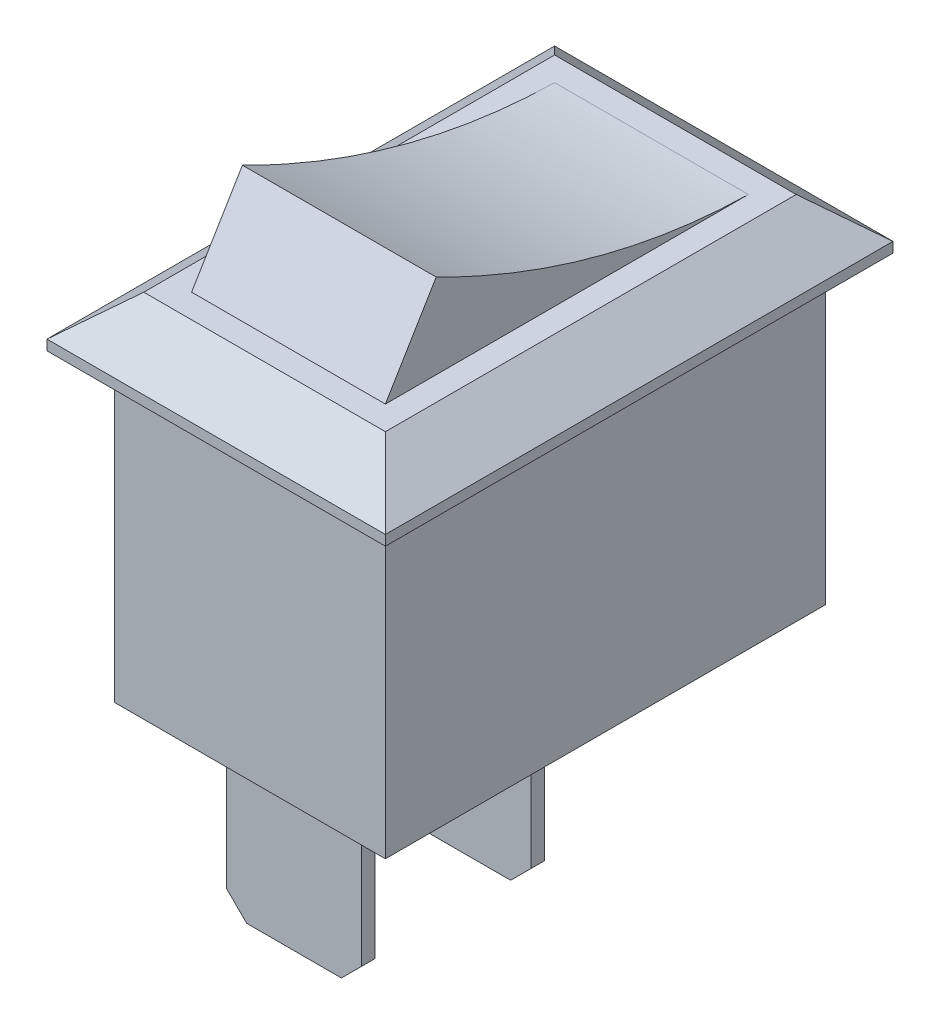
from build123d import *
from OCP.BRepFilletAPI import BRepFilletAPI_MakeChamfer

# Parameters (mm, degrees)
SKETCH1_W           = 8
SKETCH1_H           = 13
BOSS_EXTRUDE1_DEPTH = 9
SKETCH2_W           = 10
SKETCH2_H           = 15
BOSS_EXTRUDE2_DEPTH = 1.5
CHAMFER1_SIZE       = 1.2
CHAMFER1_SIZE2      = 1.430104311
SKETCH3_W           = 5.725577816
SKETCH3_H           = 10.725577816
BOSS_EXTRUDE3_DEPTH = 2.5
CUT_EXTRUDE2_DEPTH  = 10
CUT_EXTRUDE3_DEPTH  = 10
SKETCH6_W           = 4
SKETCH6_H           = 0.4
BOSS_EXTRUDE4_DEPTH = 5
CHAMFER2_SIZE       = 0.6
LPATTERN1_COUNT     = 2
LPATTERN1_PITCH     = 5
CHAMFER3_SIZE       = 0.6


with BuildPart() as part:
    # Sketch1 → Boss-Extrude1 (new body)
    with BuildSketch(Plane(origin=(0, 0, 0), x_dir=(1, 0, 0), z_dir=(0, 1, 0))):
        Rectangle(SKETCH1_W, SKETCH1_H)
    extrude(amount=BOSS_EXTRUDE1_DEPTH)

    # Sketch2 → Boss-Extrude2 (add)
    with BuildSketch(Plane(origin=(0, 9, 0), x_dir=(1, 0, 0), z_dir=(0, 1, 0))):
        Rectangle(SKETCH2_W, SKETCH2_H)
    extrude(amount=BOSS_EXTRUDE2_DEPTH)

    # Chamfer1: one chamfer whose edges measure the first distance from different faces: ONE call of the kernel's chamfer builder (chamfer() names one face for all edges)
    chamfer1_edges_1 = [part.edges().sort_by_distance(p)[0] for p in [
        (5, 10.5, 0),
    ]]
    chamfer1_side_1 = [part.faces().sort_by_distance(p)[0] for p in [
        (5, 9.75, 0),
    ]]
    chamfer1_edges_2 = [part.edges().sort_by_distance(p)[0] for p in [
        (0, 10.5, -7.5),
    ]]
    chamfer1_side_2 = [part.faces().sort_by_distance(p)[0] for p in [
        (0, 9.75, -7.5),
    ]]
    chamfer1_edges_3 = [part.edges().sort_by_distance(p)[0] for p in [
        (-5, 10.5, 0),
    ]]
    chamfer1_side_3 = [part.faces().sort_by_distance(p)[0] for p in [
        (-5, 9.75, 0),
    ]]
    chamfer1_edges_4 = [part.edges().sort_by_distance(p)[0] for p in [
        (0, 10.5, 7.5),
    ]]
    chamfer1_side_4 = [part.faces().sort_by_distance(p)[0] for p in [
        (0, 9.75, 7.5),
    ]]
    chamfer1 = BRepFilletAPI_MakeChamfer(part.part.solid().wrapped)
    for e in chamfer1_edges_1:
        chamfer1.Add(CHAMFER1_SIZE, CHAMFER1_SIZE2, e.wrapped, chamfer1_side_1[0].wrapped)  # the first distance lies on this face
    for e in chamfer1_edges_2:
        chamfer1.Add(CHAMFER1_SIZE, CHAMFER1_SIZE2, e.wrapped, chamfer1_side_2[0].wrapped)  # the first distance lies on this face
    for e in chamfer1_edges_3:
        chamfer1.Add(CHAMFER1_SIZE, CHAMFER1_SIZE2, e.wrapped, chamfer1_side_3[0].wrapped)  # the first distance lies on this face
    for e in chamfer1_edges_4:
        chamfer1.Add(CHAMFER1_SIZE, CHAMFER1_SIZE2, e.wrapped, chamfer1_side_4[0].wrapped)  # the first distance lies on this face
    add(Compound.cast(chamfer1.Shape()), mode=Mode.REPLACE)

    # Sketch3 → Boss-Extrude3 (add)
    with BuildSketch(Plane(origin=(0, 10.5, 0), x_dir=(1, 0, 0), z_dir=(0, 1, 0))):
        Rectangle(SKETCH3_W, SKETCH3_H)
    extrude(amount=BOSS_EXTRUDE3_DEPTH)

    # Sketch4 → Cut-Extrude2 (cut)
    with BuildSketch(Plane.ZY.offset(2.862788908)):
        Polygon((5.362788908, 13), (3.862788908, 13), (5.362788908, 10.5), align=None)
    extrude(amount=-CUT_EXTRUDE2_DEPTH, mode=Mode.SUBTRACT)

    # Sketch5 → Cut-Extrude3 (cut)
    with BuildSketch(Plane.ZY.offset(2.862788908)):
        with BuildLine():
            Line((-5.362788908, 10.5), (-5.362788908, 13))
            Line((-5.362788908, 13), (3.862788908, 13))
            add(Edge.make_bspline(
                [(3.862788908, 13), (-0.886352769, 10.585649202), (-5.362788908, 10.5)],
                knots=[0, 0, 0, 0.869788285, 0.869788285, 0.869788285], degree=2))
        make_face()
    extrude(amount=-CUT_EXTRUDE3_DEPTH, mode=Mode.SUBTRACT)

    # Sketch6 → Boss-Extrude4 (add)
    with BuildSketch(Plane.XZ):
        with Locations((0, 5)):
            Rectangle(SKETCH6_W, SKETCH6_H)
    boss_extrude4 = extrude(amount=BOSS_EXTRUDE4_DEPTH)

    # Chamfer2
    chamfer2_edges = [part.edges().sort_by_distance(p)[0] for p in [
        (2, -5, 5),
        (-2, -5, 5),
    ]]
    chamfer(chamfer2_edges, length=CHAMFER2_SIZE)

    # LPattern1: Boss-Extrude4 ×2
    with Locations(*[(0, 0, -i * LPATTERN1_PITCH) for i in range(1, LPATTERN1_COUNT)]):
        add(boss_extrude4)

    # Chamfer3
    chamfer3_edges = [part.edges().sort_by_distance(p)[0] for p in [
        (2, -5, 0),
        (-2, -5, 0),
    ]]
    chamfer(chamfer3_edges, length=CHAMFER3_SIZE)


solid = part.part
